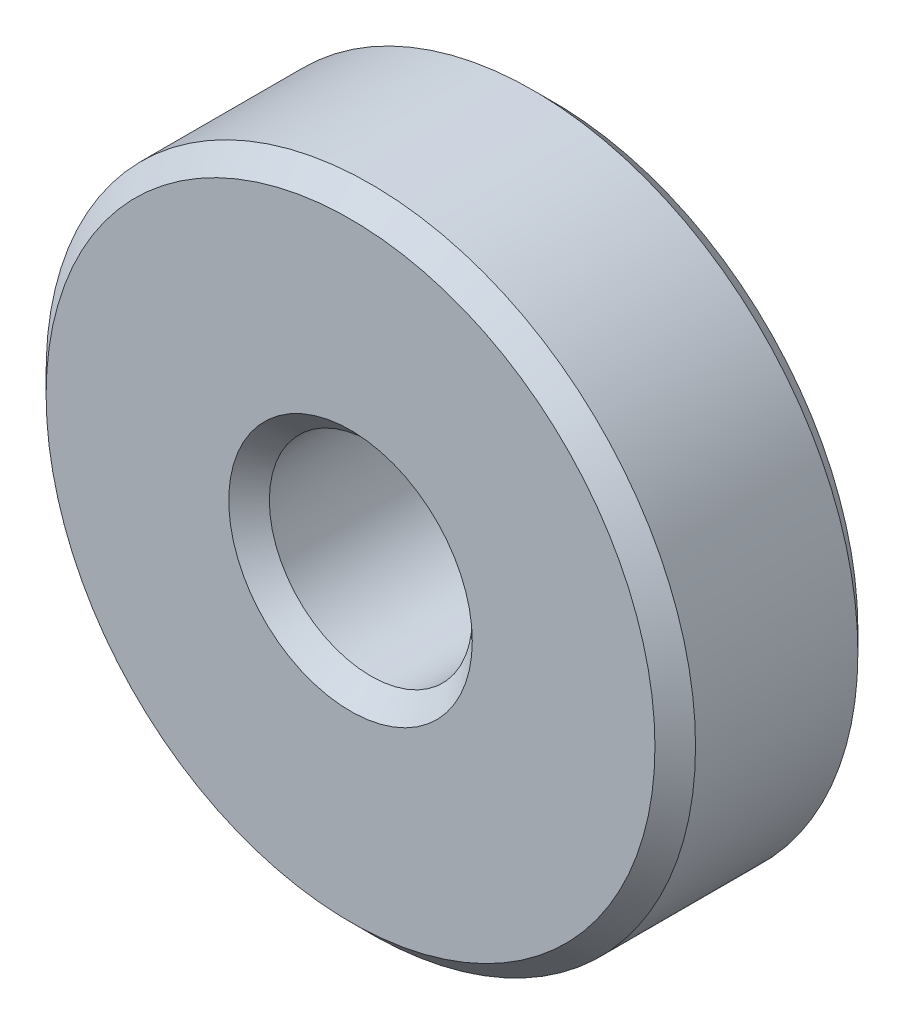
from build123d import *

# Parameters (mm, degrees)
ESQUISSE1_R        = 8
ESQUISSE1_R_2      = 2.5
BOSS_EXTRU_1_DEPTH = 5
CHANFREIN1_SIZE    = 0.5


with BuildPart() as part:
    # Esquisse1 → Boss.-Extru.1 (new body)
    with BuildSketch(Plane.XY):
        Circle(ESQUISSE1_R)
        Circle(ESQUISSE1_R_2, mode=Mode.SUBTRACT)
    extrude(amount=BOSS_EXTRU_1_DEPTH)

    # Chanfrein1
    chanfrein1_edges = [part.edges().sort_by_distance(p)[0] for p in [
        (-8, 0, 0),
        (-8, 0, 5),
        (-2.5, 0, 0),
        (-2.5, 0, 5),
    ]]
    chamfer(chanfrein1_edges, length=CHANFREIN1_SIZE)


solid = part.part
